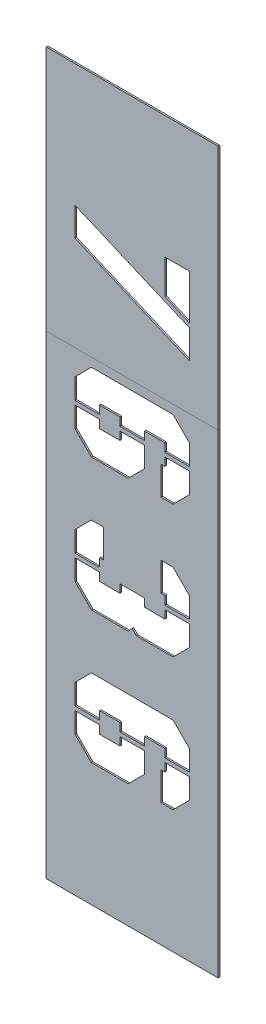
from build123d import *

# Parameters (mm, degrees)
SKETCH_1_W                     = 300.8
SKETCH_1_H                     = 1259.5
EXTRUDE_1_DEPTH                = 2.75
CUT_EXTRUDE_1_DEPTH            = 10
SPLIT_BODIES_5_SURFACE_1_BACK  = 1295.924
SPLIT_BODIES_5_SURFACE_1_DEPTH = 2591.848
SPLIT_BODIES_5_SURFACE_2_BACK  = 1295.924
SPLIT_BODIES_5_SURFACE_2_DEPTH = 2591.848


with BuildPart() as part:
    # 草圖1 → 填料-伸長1 (new body)
    with BuildSketch(Plane.XY):
        Rectangle(SKETCH_1_W, SKETCH_1_H)
    extrude(amount=EXTRUDE_1_DEPTH)

    # 草圖2 → 除料-伸長1 (cut)
    with BuildSketch(Plane.XY.offset(2.75)):
        Polygon((100, 329.625396825), (100, 279.635978836), (-83.28042328, 358.196825397), (-100, 365.35026455), (-100, 415.33968254), (83.28042328, 336.778835979), align=None)
        Polygon((57.164021164, 355.233862434), (57.164021164, 415.33968254), (100, 415.33968254), (100, 336.778835979), align=None)
        Polygon((50.010582011, 98.277248677), (57.164021164, 98.277248677), (57.164021164, 112.584126984), (100, 112.584126984), (100, 76.732275132), (71.428571429, 48.287830688), (50.010582011, 48.287830688), align=None)
        Polygon((-71.428571429, 48.287830688), (-100, 76.732275132), (-100, 112.584126984), (-57.121693122, 112.584126984), (-57.121693122, 98.277248677), (-21.439153439, 98.277248677), (-21.439153439, 112.584126984), (21.439153439, 112.584126984), (21.439153439, 76.859259259), (-7.132275132, 48.287830688), align=None)
        Polygon((-21.439153439, 134.002116402), (-57.121693122, 134.002116402), (-57.121693122, 119.568253968), (-100, 119.737566138), (-100, 155.42010582), (-71.428571429, 184.160846561), (71.428571429, 183.991534392), (100, 155.42010582), (100, 119.568253968), (57.164021164, 119.568253968), (57.164021164, 134.002116402), (21.439153439, 134.002116402), (21.439153439, 119.737566138), (-21.439153439, 119.737566138), align=None)
        Polygon((21.566137566, -132.901587302), (57.164021164, -132.901587302), (57.164021164, -118.764021164), (100, -118.764021164), (100, -154.615873016), (71.428571429, -183.06031746), (7.132275132, -183.06031746), (0.021164021, -175.77989418), (-7.005291005, -183.187301587), (-71.301587302, -183.187301587), (-99.873015873, -154.785185185), (-100, -118.764021164), (-57.121693122, -118.764021164), (-56.994708995, -133.070899471), (-21.26984127, -133.070899471), (-21.439153439, -118.764021164), (21.26984127, -118.637037037), (21.26984127, -118.891005291), (21.566137566, -118.891005291), align=None)
        Polygon((50.010582011, -47.187301587), (71.428571429, -47.187301587), (100, -75.928042328), (100, -111.77989418), (57.164021164, -111.77989418), (57.164021164, -97.346031746), (50.010582011, -97.346031746), align=None)
        Polygon((-50.010582011, -97.346031746), (-57.121693122, -97.346031746), (-57.121693122, -111.77989418), (-100, -111.610582011), (-100, -75.928042328), (-71.428571429, -47.187301587), (-50.010582011, -47.187301587), align=None)
        Polygon((50.010582011, -364.419047619), (57.164021164, -364.419047619), (57.164021164, -350.112169312), (100, -350.112169312), (100, -385.964021164), (71.428571429, -414.408465608), (50.010582011, -414.408465608), align=None)
        Polygon((-71.428571429, -414.408465608), (-100, -385.964021164), (-100, -350.112169312), (-57.121693122, -350.112169312), (-57.121693122, -364.419047619), (-21.439153439, -364.419047619), (-21.439153439, -350.112169312), (21.439153439, -350.112169312), (21.439153439, -385.837037037), (-7.132275132, -414.408465608), align=None)
        Polygon((-21.439153439, -328.694179894), (-57.121693122, -328.694179894), (-57.121693122, -343.128042328), (-100, -342.958730159), (-100, -307.276190476), (-71.428571429, -278.535449735), (71.428571429, -278.704761905), (100, -307.276190476), (100, -343.128042328), (57.164021164, -343.128042328), (57.164021164, -328.694179894), (21.439153439, -328.694179894), (21.439153439, -342.958730159), (-21.439153439, -342.958730159), align=None)
    extrude(amount=-CUT_EXTRUDE_1_DEPTH, mode=Mode.SUBTRACT)


with BuildPart() as body_2:
    # Split Bodies 5: the piece behind the surface
    add(part.part)
    # Split Bodies 5 surface: a surface, the sketch's curves swept straight by 2591.848 mm
    with BuildLine(Plane.XY.offset(2.75).offset(-SPLIT_BODIES_5_SURFACE_1_BACK), mode=Mode.PRIVATE) as split_bodies_5_surface_1_path:
        Line((-150.4, 199.6), (150.4, 199.6))
    split_bodies_5_surface_1 = Shell.extrude(split_bodies_5_surface_1_path.wire(), (0 * SPLIT_BODIES_5_SURFACE_1_DEPTH, 0 * SPLIT_BODIES_5_SURFACE_1_DEPTH, 1 * SPLIT_BODIES_5_SURFACE_1_DEPTH))
    split(bisect_by=split_bodies_5_surface_1, keep=Keep.BOTTOM)


with BuildPart() as part_1:
    add(part.part)

    # Split Bodies 5: split by a surface, the side it looks to stays
    # Split Bodies 5 surface: a surface, the sketch's curves swept straight by 2591.848 mm
    with BuildLine(Plane.XY.offset(2.75).offset(-SPLIT_BODIES_5_SURFACE_2_BACK), mode=Mode.PRIVATE) as split_bodies_5_surface_2_path:
        Line((-150.4, 199.6), (150.4, 199.6))
    split_bodies_5_surface_2 = Shell.extrude(split_bodies_5_surface_2_path.wire(), (0 * SPLIT_BODIES_5_SURFACE_2_DEPTH, 0 * SPLIT_BODIES_5_SURFACE_2_DEPTH, 1 * SPLIT_BODIES_5_SURFACE_2_DEPTH))
    split(bisect_by=split_bodies_5_surface_2, keep=Keep.TOP)


solid = Compound([body_2.part, part_1.part])
